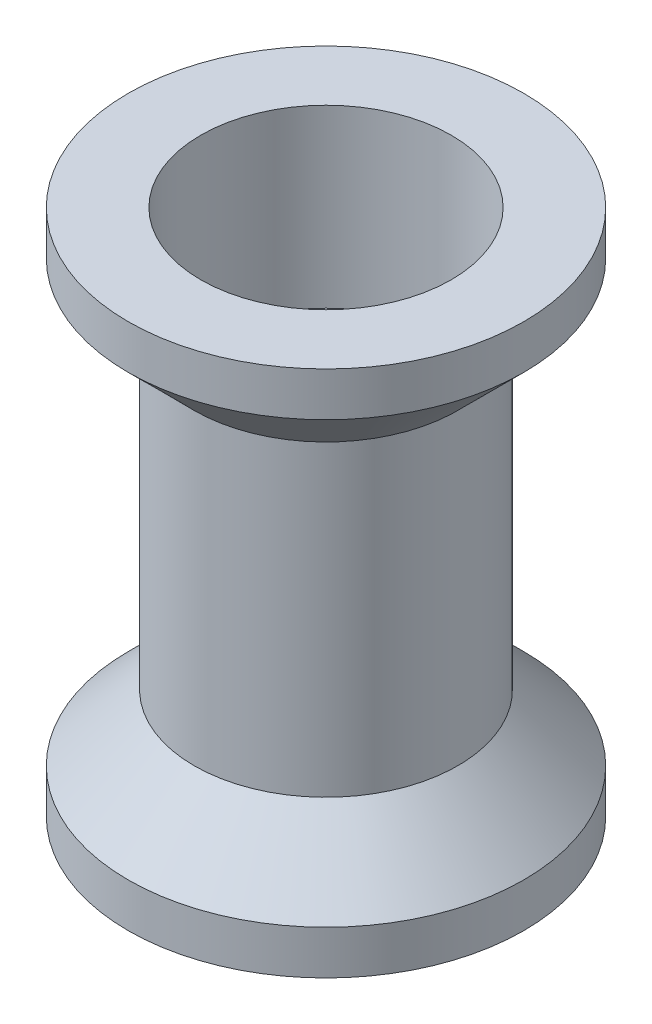
from build123d import *

# Parameters (mm, degrees)
SKETCH1_R           = 22.5
BOSS_EXTRUDE1_DEPTH = 60
SKETCH2_R           = 14.25
CUT_EXTRUDE1_DEPTH  = 20


with BuildPart() as part:
    # Sketch1 → Boss-Extrude1 (new body)
    with BuildSketch(Plane(origin=(0, 0, 0), x_dir=(1, 0, 0), z_dir=(0, 1, 0))):
        with Locations(Location((0, 0, 0), (0, 0, 270))):
            Circle(SKETCH1_R)
        with BuildLine():
            Line((1.767766953, 1.767766953), (-1.767766953, 1.767766953))
            ThreePointArc((-1.767766953, 1.767766953), (0, -2.5), (1.767766953, 1.767766953))
        make_face(mode=Mode.SUBTRACT)
    extrude(amount=BOSS_EXTRUDE1_DEPTH)

    # Sketch2 → Cut-Extrude1 (cut)
    with BuildSketch(Plane(origin=(0, 60, 0), x_dir=(1, 0, 0), z_dir=(0, 1, 0))):
        with Locations(Location((0, 0, 0), (0, 0, 270))):
            Circle(SKETCH2_R)
    extrude(amount=-CUT_EXTRUDE1_DEPTH, mode=Mode.SUBTRACT)

    # Sketch4 → Cut-Revolve3 (revolve, cut)
    with BuildSketch(Plane.XY, mode=Mode.PRIVATE) as cut_revolve3_sk:
        Polygon((22.5, 5), (22.5, 55), (15, 47.5), (15, 12.5), align=None)
    revolve(cut_revolve3_sk.sketch.rotate(Axis((0, -24.387590134, 0), (0, 1, 0)), 90), axis=Axis((0, -24.387590134, 0), (0, 1, 0)), mode=Mode.SUBTRACT)


solid = part.part
